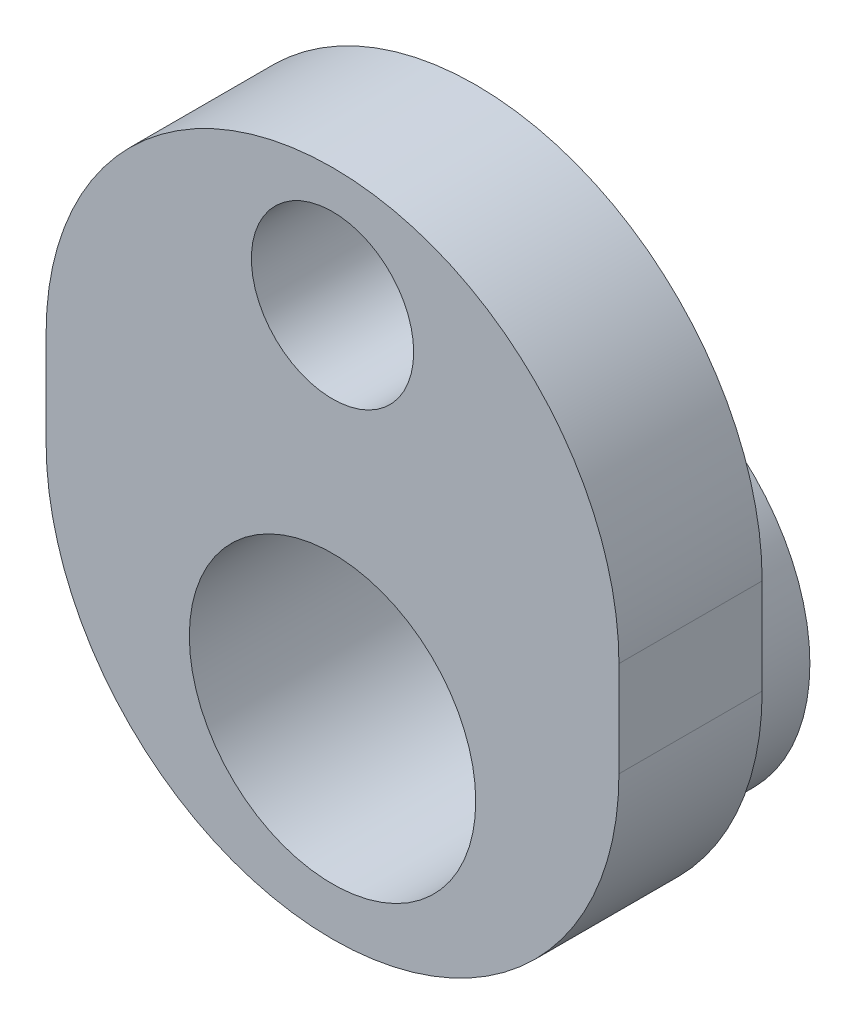
from build123d import *

# Parameters (mm, degrees)
SKETCH1_R           = 1.7
SKETCH1_R_2         = 3
BOSS_EXTRUDE1_DEPTH = 3
BOSS_EXTRUDE2_START = -3
SKETCH1_3_R         = 4
SKETCH1_3_R_2       = 3
BOSS_EXTRUDE2_DEPTH = 3


with BuildPart() as part:
    # Sketch1 → Boss-Extrude1 (new body)
    with BuildSketch(Plane.XY):
        with BuildLine():
            Line((-6, 4), (-6, 2))
            ThreePointArc((-6, 2), (0, -4), (6, 2))
            Line((6, 2), (6, 4))
            ThreePointArc((6, 4), (0, 10), (-6, 4))
        make_face()
        with Locations((0, 7.5)):
            Circle(SKETCH1_R, mode=Mode.SUBTRACT)
        Circle(SKETCH1_R_2, mode=Mode.SUBTRACT)
    extrude(amount=BOSS_EXTRUDE1_DEPTH)

    # Sketch1<3> → Boss-Extrude2 (add)
    with BuildSketch(Plane.XY.offset(BOSS_EXTRUDE2_START)):
        Circle(SKETCH1_3_R)
        Circle(SKETCH1_3_R_2, mode=Mode.SUBTRACT)
    extrude(amount=BOSS_EXTRUDE2_DEPTH)


solid = part.part
